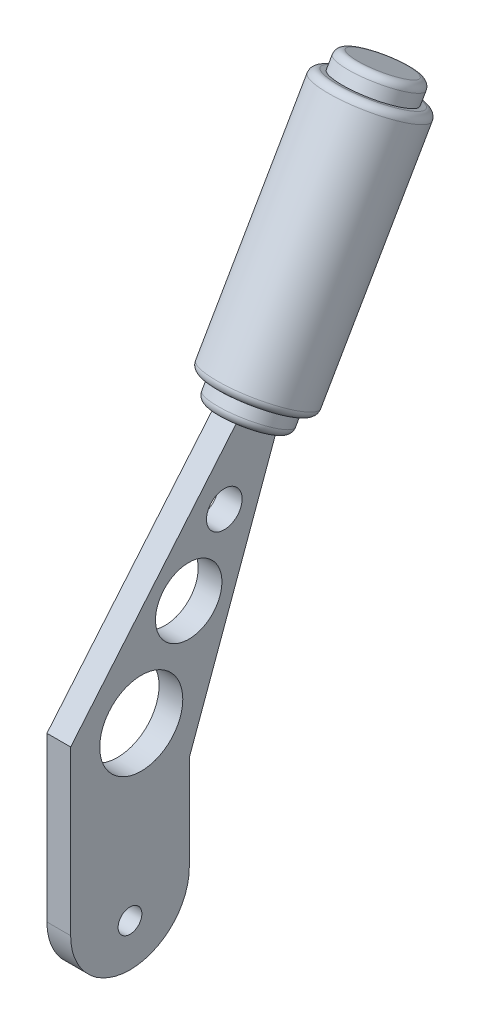
from build123d import *

# Parameters (mm, degrees)
DODANIE_WYCI_GNI_CIE1_DEPTH      = 5
DODANIE_WYCI_GNI_CIE1_DEPTH_BACK = 5
SZKIC1_R                         = 7.5
SZKIC1_R_2                       = 14
SZKIC1_R_3                       = 17.5
SZKIC1_R_4                       = 5
ZAOKR_GLENIE1_R                  = 3
ZAOKR_GLENIE2_R                  = 3


with BuildPart() as part:
    # Szkic1 → Dodanie-wyciągnięcie1 (new, two sides: drawn at the far end of the back side and taken through both)
    with BuildSketch(Plane(origin=(0, 0, 0), x_dir=(0, 0, -1), z_dir=(1, 0, 0)).offset(-DODANIE_WYCI_GNI_CIE1_DEPTH_BACK)):
        with BuildLine():
            Line((-25, 0), (-25, 68.867513459))
            Line((-25, 68.867513459), (44.841238994, 152.101060942))
            Line((44.841238994, 152.101060942), (62.16174707, 142.101060942))
            Line((62.16174707, 142.101060942), (25, 40))
            Line((25, 40), (25, 0))
            ThreePointArc((25, 0), (0, -25), (-25, 0))
        make_face()
        with Locations((39.751493032, 123.285362338)):
            Circle(SZKIC1_R, mode=Mode.SUBTRACT)
        with Locations((24.751493032, 97.304600224)):
            Circle(SZKIC1_R_2, mode=Mode.SUBTRACT)
        with Locations((4.751493032, 62.663584073)):
            Circle(SZKIC1_R_3, mode=Mode.SUBTRACT)
        with Locations((0, -7)):
            Circle(SZKIC1_R_4, mode=Mode.SUBTRACT)
    extrude(amount=DODANIE_WYCI_GNI_CIE1_DEPTH + DODANIE_WYCI_GNI_CIE1_DEPTH_BACK)

    # Szkic3 → Obrót1 (revolve)
    with BuildSketch(Plane(origin=(0, 0, 0), x_dir=(0, 0, -1), z_dir=(1, 0, 0))):
        Polygon((40.511111975, 154.601060942), (53.501493032, 147.101060942), (111.501493032, 247.560007781), (98.511111975, 255.060007781), (94.511111975, 248.131804551), (90.180984956, 250.631804551), (40.180984956, 164.029264172), (44.511111975, 161.529264172), align=None)
    revolve(axis=Axis((0, 147.101060942, -53.501493032), (0, 0.8660254037844385, -0.5000000000000003)))

    # Zaokrąglenie1
    zaokr_glenie1_edges = [part.edges().sort_by_distance(p)[0] for p in [
        (0, 240.060007781, -124.491874089),
        (0, 139.601060942, -66.491874089),
    ]]
    fillet(zaokr_glenie1_edges, radius=ZAOKR_GLENIE1_R)

    # Zaokrąglenie2
    zaokr_glenie2_edges = [part.edges().sort_by_distance(p)[0] for p in [
        (0, 144.029264172, -74.822001108),
        (0, 230.631804551, -124.822001108),
    ]]
    fillet(zaokr_glenie2_edges, radius=ZAOKR_GLENIE2_R)


solid = part.part
